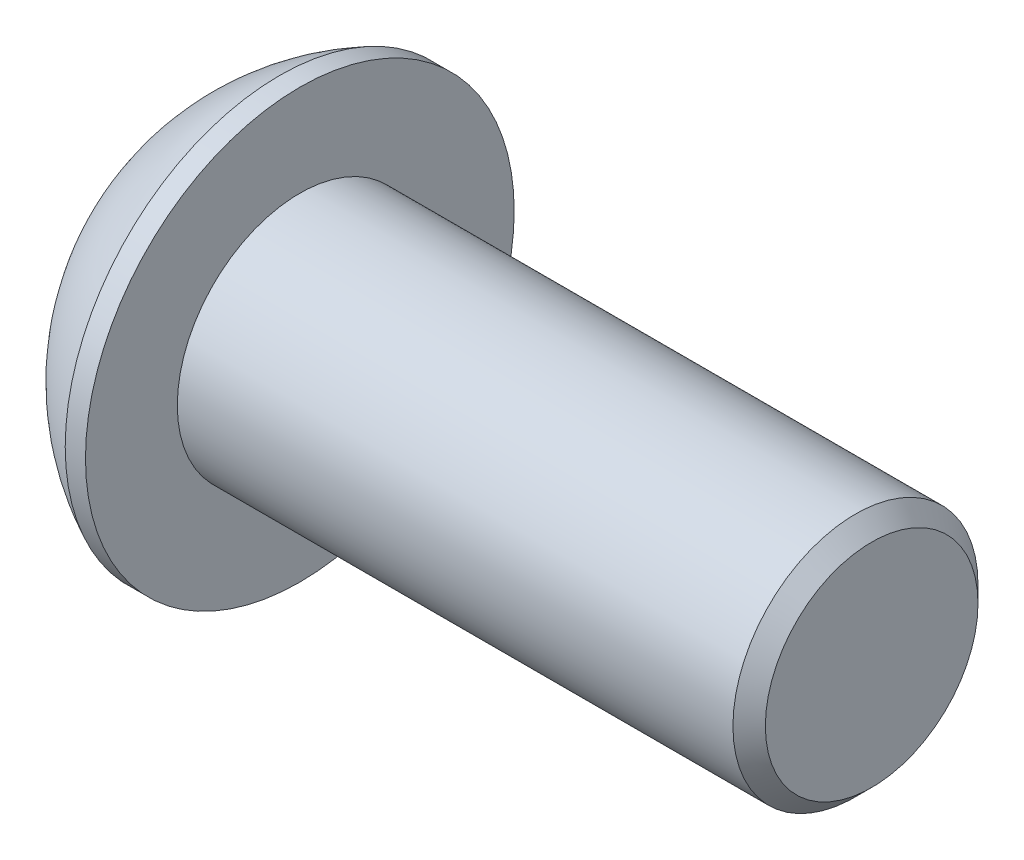
from build123d import *

# Parameters (mm, degrees)
HEX_2_DEPTH = 3.0988


with BuildPart() as part:
    # BodySke → BaseBody (revolve)
    with BuildSketch(Plane.XY, mode=Mode.PRIVATE) as basebody_sk:
        with BuildLine():
            Line((27.2796, 0), (27.2796, 4.13258))
            Line((27.2796, 4.13258), (26.64968, 4.7625))
            Line((26.64968, 4.7625), (5.0546, 4.7625))
            Line((5.0546, 4.7625), (5.0546, 8.3312))
            Line((5.0546, 8.3312), (4.2672, 8.3312))
            ThreePointArc((4.2672, 8.3312), (1.787801933, 6.602632166), (0, 4.1656))
            Line((0, 4.1656), (0, 0))
            Line((0, 0), (27.2796, 0))
        make_face()
    revolve(basebody_sk.sketch.rotate(Axis((0, 0, 0), (1, 0, 0)), 90), axis=Axis((0, 0, 0), (1, 0, 0)))

    # Sketch2 → PreBroach (revolve, cut)
    with BuildSketch(Plane.XY, mode=Mode.PRIVATE) as prebroach_sk:
        Polygon((0, 2.7813), (3.0988, 2.7813), (4.704584304, 0), (0, 0), align=None)
    revolve(prebroach_sk.sketch.rotate(Axis((0, 0, 0), (1, 0, 0)), 90), axis=Axis((0, 0, 0), (1, 0, 0)), mode=Mode.SUBTRACT)

    # Sketch3 → Hex 2 (cut)
    with BuildSketch(Plane(origin=(0, 0, 0), x_dir=(0, 0, -1), z_dir=(1, 0, 0))):
        Polygon((-2.7813, -1.605784304), (-2.7813, 1.605784304), (0, 3.211568607), (2.7813, 1.605784304), (2.7813, -1.605784304), (0, -3.211568607), align=None)
    extrude(amount=HEX_2_DEPTH, mode=Mode.SUBTRACT)


solid = part.part
